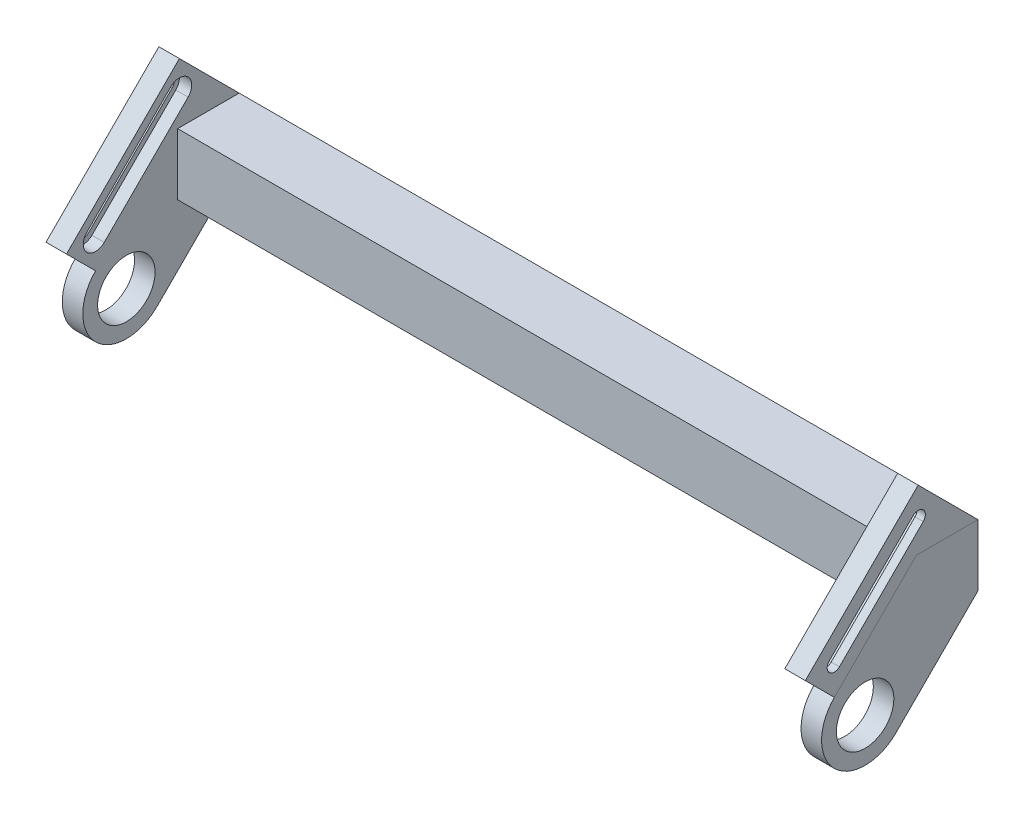
from build123d import *

# Parameters (mm, degrees)
EXTRUDE_1_DEPTH      = 87.5
EXTRUDE_1_DEPTH_BACK = 87.5
SKETCH_2_R           = 7
EXTRUDE_2_DEPTH      = 5
EXTRUDE_3_DEPTH      = 5
CUT_EXTRUDE_1_DEPTH  = 10
CUT_EXTRUDE_2_DEPTH  = 3


with BuildPart() as part:
    # 草图1 → 凸台-拉伸1 (new, two sides: drawn at the far end of the back side and taken through both)
    with BuildSketch(Plane(origin=(0, 0, 0), x_dir=(0, 0, -1), z_dir=(1, 0, 0)).offset(-EXTRUDE_1_DEPTH_BACK)):
        Polygon((12.5, 12.5), (15, 15), (15, 25), (25, 25), (25, 15), (27.5, 12.5), (27.5, 27.5), (12.5, 27.5), align=None)
    extrude(amount=EXTRUDE_1_DEPTH + EXTRUDE_1_DEPTH_BACK)

    # 草图2 → 凸台-拉伸2 (add)
    with BuildSketch(Plane(origin=(87.5, 0, 0), x_dir=(0, 0, -1), z_dir=(1, 0, 0))):
        with BuildLine():
            Line((-7.5, 7.5), (12.5, 27.5))
            Line((12.5, 27.5), (27.5, 27.5))
            Line((27.5, 27.5), (27.5, 12.5))
            Line((27.5, 12.5), (7.5, -7.5))
            ThreePointArc((7.5, -7.5), (-7.5, -7.5), (-7.5, 7.5))
        make_face()
        Circle(SKETCH_2_R, mode=Mode.SUBTRACT)
    extrude_2 = extrude(amount=EXTRUDE_2_DEPTH)

    # 镜向4: 凸台-拉伸2 across plane
    add(extrude_2.mirror(Plane(origin=(0, 0, 0), x_dir=(0, 0, 1), z_dir=(1, 0, 0))))


with BuildPart() as body_2:
    # 草图3 → 凸台-拉伸3 (new body)
    with BuildSketch(Plane(origin=(92.5, 0, 0), x_dir=(0, 0, -1), z_dir=(1, 0, 0))):
        Polygon((27.5, 27.5), (12.928932188, 42.071067812), (-14.571067812, 14.571067812), (-7.5, 7.5), (12.5, 27.5), align=None)
    extrude_3 = extrude(amount=-EXTRUDE_3_DEPTH)

    # 草图4 → 切除-拉伸1 (cut)
    with BuildSketch(Plane(origin=(92.5, 0, 0), x_dir=(0, 0, -1), z_dir=(1, 0, 0))):
        with BuildLine():
            Line((-8.737436867, 15.808504679), (11.691495321, 36.237436867))
            ThreePointArc((11.691495321, 36.237436867), (14.166369055, 36.237436867), (14.166369055, 33.762563133))
            Line((14.166369055, 33.762563133), (-6.262563133, 13.333630945))
            ThreePointArc((-6.262563133, 13.333630945), (-8.737436867, 13.333630945), (-8.737436867, 15.808504679))
        make_face()
    cut_extrude_1 = extrude(amount=-CUT_EXTRUDE_1_DEPTH, mode=Mode.SUBTRACT)

    # 草图5 → 切除-拉伸2 (cut)
    with BuildSketch(Plane.ZY.offset(-87.5)):
        with BuildLine():
            Line((-10.807611845, 37.121320344), (9.621320344, 16.692388155))
            ThreePointArc((9.621320344, 16.692388155), (9.621320344, 12.449747468), (5.378679656, 12.449747468))
            Line((5.378679656, 12.449747468), (-15.050252532, 32.878679656))
            ThreePointArc((-15.050252532, 32.878679656), (-15.050252532, 37.121320344), (-10.807611845, 37.121320344))
        make_face()
    cut_extrude_2 = extrude(amount=-CUT_EXTRUDE_2_DEPTH, mode=Mode.SUBTRACT)


with BuildPart() as part_1:
    add(part.part)

    # 镜向7: 凸台-拉伸3, 切除-拉伸1, 切除-拉伸2 across plane
    add(extrude_3.mirror(Plane(origin=(0, 0, 0), x_dir=(0, 0, 1), z_dir=(1, 0, 0))))
    add(cut_extrude_1.mirror(Plane(origin=(0, 0, 0), x_dir=(0, 0, 1), z_dir=(1, 0, 0))), mode=Mode.SUBTRACT)
    add(cut_extrude_2.mirror(Plane(origin=(0, 0, 0), x_dir=(0, 0, 1), z_dir=(1, 0, 0))), mode=Mode.SUBTRACT)


solid = Compound([body_2.part, part_1.part])
